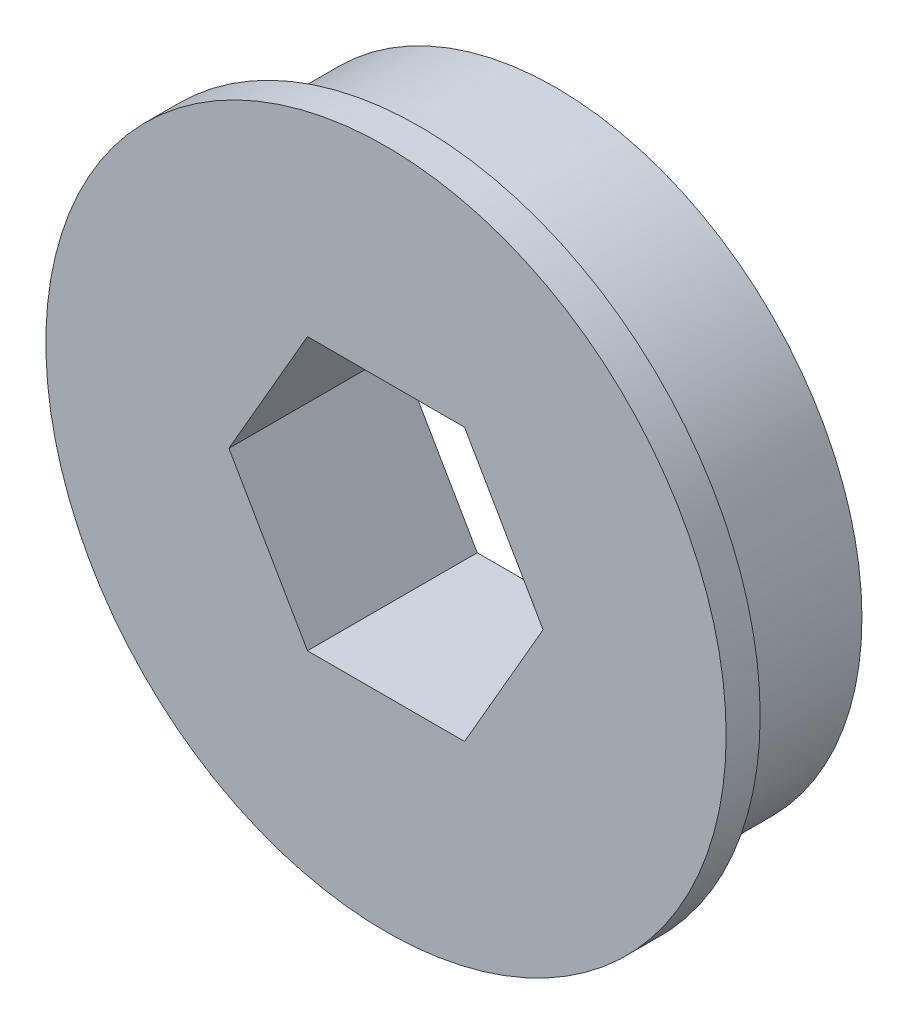
from build123d import *

# Parameters (mm, degrees)
CUT_EXTRUDE1_DEPTH = 24.808269678


with BuildPart() as part:
    # Sketch1 → Revolve1 (revolve)
    with BuildSketch(Plane(origin=(0, 0, 0), x_dir=(0, 0, -1), z_dir=(1, 0, 0)), mode=Mode.PRIVATE) as revolve1_sk:
        Polygon((0, 15.875), (0, 0), (7.9248, 0), (7.9248, 14.2875), (1.5875, 14.2875), (1.5875, 15.875), align=None)
    revolve(revolve1_sk.sketch.rotate(Axis((0, 0, 0), (0, 0, -1)), 90), axis=Axis((0, 0, 0), (0, 0, -1)))

    # Sketch2 → Cut-Extrude1 (cut, through all)
    with BuildSketch(Plane.XY):
        Polygon((7.332348419, 0), (3.666174209, 6.35), (-3.666174209, 6.35), (-7.332348419, 0), (-3.666174209, -6.35), (3.666174209, -6.35), align=None)
    extrude(amount=-CUT_EXTRUDE1_DEPTH, mode=Mode.SUBTRACT)


solid = part.part
